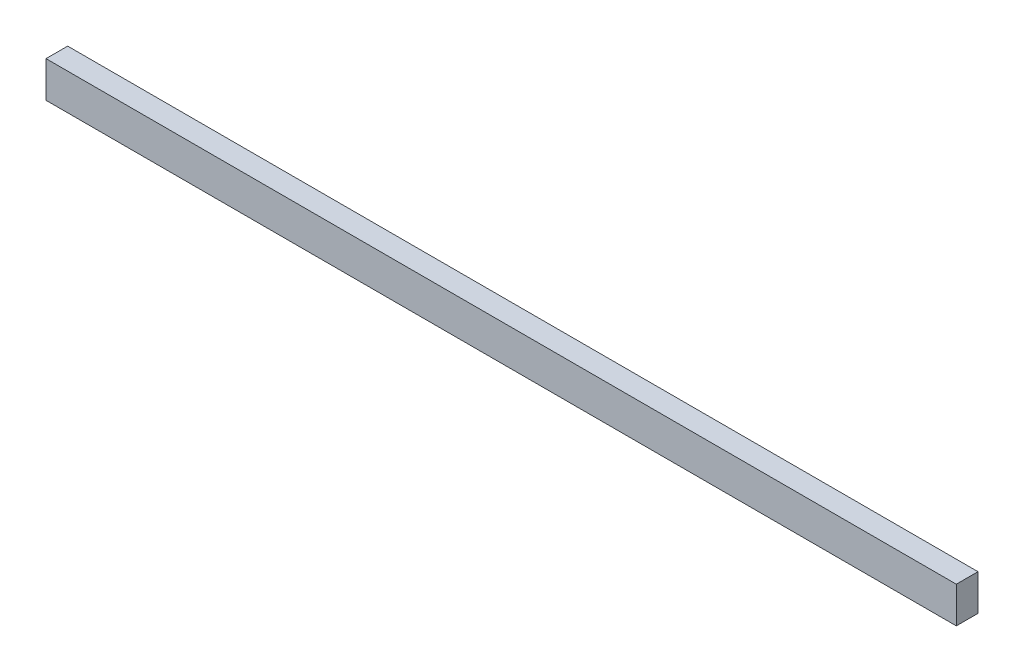
from build123d import *

# Parameters (mm, degrees)
SKETCH1_W           = 800.1
SKETCH1_H           = 19.05
BOSS_EXTRUDE1_DEPTH = 31.75


with BuildPart() as part:
    # Sketch1 → Boss-Extrude1 (new body)
    with BuildSketch(Plane(origin=(0, 0, 0), x_dir=(1, 0, 0), z_dir=(0, 1, 0))):
        Rectangle(SKETCH1_W, SKETCH1_H)
    extrude(amount=BOSS_EXTRUDE1_DEPTH)


solid = part.part
